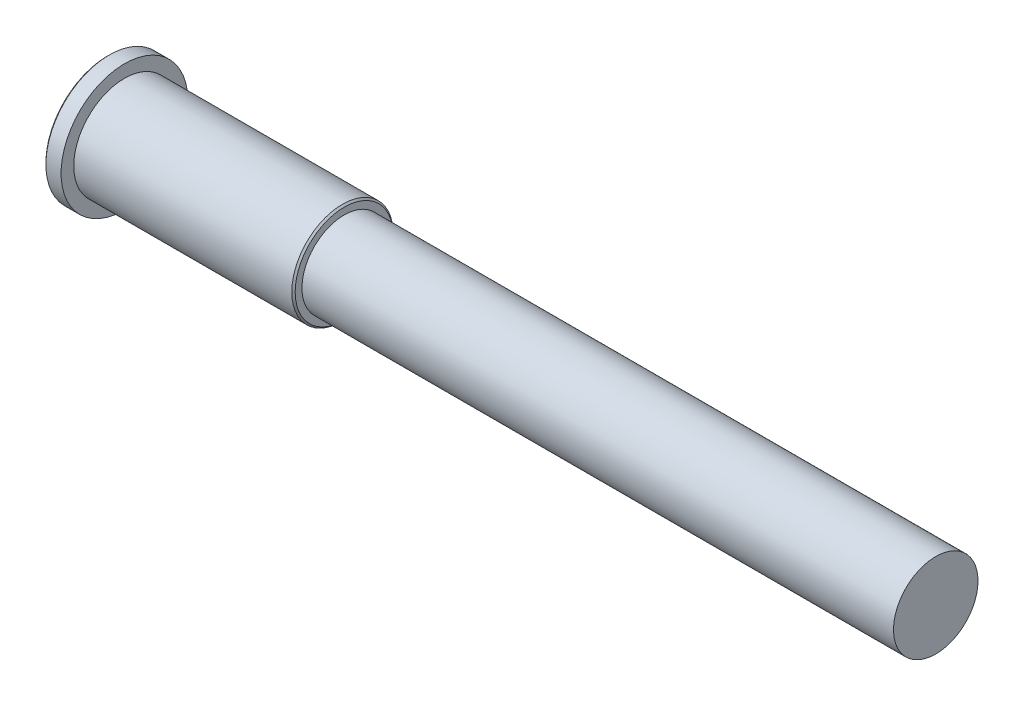
from build123d import *

# Parameters (mm, degrees)
SKETCH1_R           = 7.5
BOSS_EXTRUDE1_DEPTH = 2
SKETCH2_R           = 6
BOSS_EXTRUDE2_DEPTH = 26
SKETCH3_R           = 5
BOSS_EXTRUDE3_DEPTH = 70
CHAMFER1_SIZE       = 0.2


with BuildPart() as part:
    # Sketch1 → Boss-Extrude1 (new body)
    with BuildSketch(Plane(origin=(0, 0, 0), x_dir=(0, 0, -1), z_dir=(1, 0, 0))):
        Circle(SKETCH1_R)
    extrude(amount=BOSS_EXTRUDE1_DEPTH)

    # Sketch2 → Boss-Extrude2 (add)
    with BuildSketch(Plane(origin=(2, 0, 0), x_dir=(0, 0, -1), z_dir=(1, 0, 0))):
        with Locations(Location((0, 0, 0), (0, 0, 180))):
            Circle(SKETCH2_R)
    extrude(amount=BOSS_EXTRUDE2_DEPTH)

    # Sketch3 → Boss-Extrude3 (add)
    with BuildSketch(Plane(origin=(28, 0, 0), x_dir=(0, 0, -1), z_dir=(1, 0, 0))):
        Circle(SKETCH3_R)
    extrude(amount=BOSS_EXTRUDE3_DEPTH)

    # Chamfer1
    chamfer1_edges = [part.edges().sort_by_distance(p)[0] for p in [
        (0, 0, 7.5),
        (28, 0, -6),
    ]]
    chamfer(chamfer1_edges, length=CHAMFER1_SIZE)


solid = part.part
